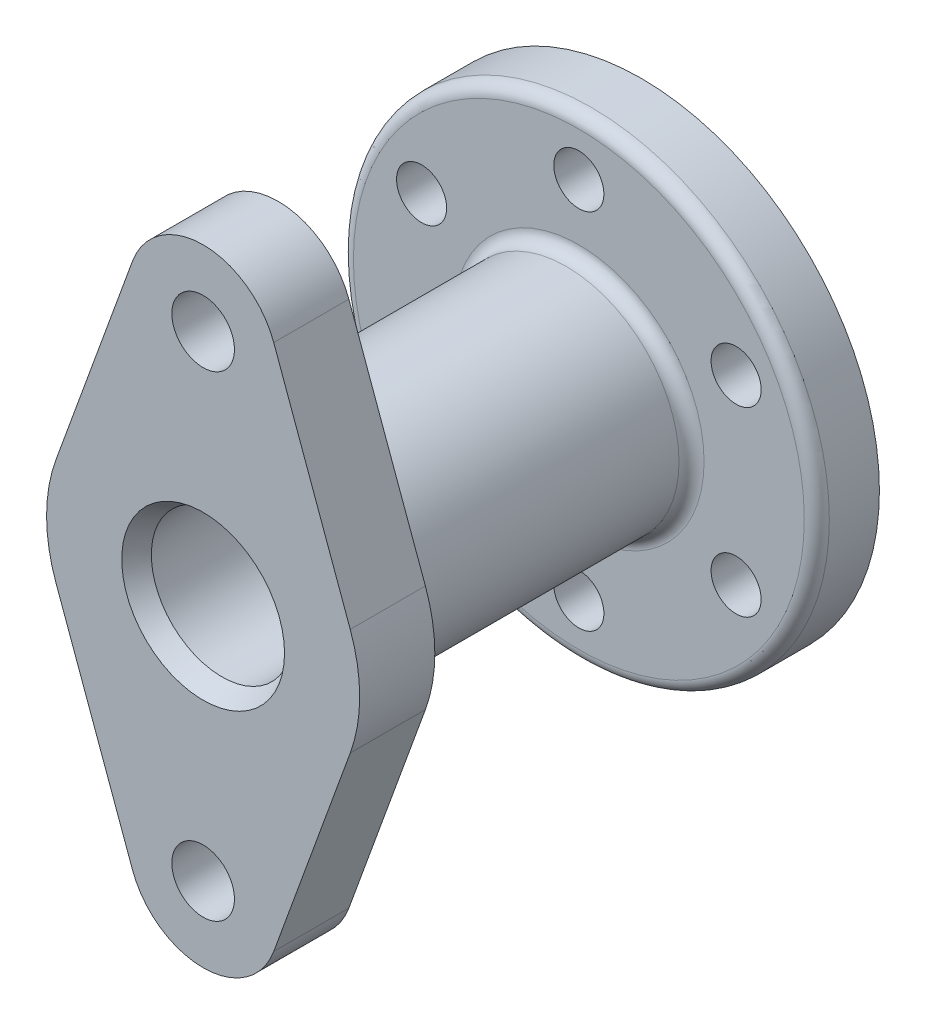
from build123d import *

# Parameters (mm, degrees)
SKETCH1_R           = 5
BOSS_EXTRUDE1_DEPTH = 6
SKETCH2_R           = 13
CUT_EXTRUDE1_DEPTH  = 3
CUT_EXTRUDE1_DRAFT  = -30
SKETCH3_R           = 18
BOSS_EXTRUDE2_DEPTH = 48
SKETCH4_R           = 38
BOSS_EXTRUDE3_DEPTH = 10
SKETCH5_R           = 11.267949192
CUT_EXTRUDE2_DEPTH  = 25
SKETCH6_R           = 10
CUT_EXTRUDE3_DEPTH  = 76.55130707
SKETCH7_R           = 4
CUT_EXTRUDE4_DEPTH  = 87.856203002
FILLET1_R           = 2


with BuildPart() as part:
    # Sketch1 → Boss-Extrude1 (new, symmetric)
    with BuildSketch(Plane.XY):
        with BuildLine():
            Line((23.491540883, -8.552631579), (11.275939624, -42.105263158))
            ThreePointArc((11.275939624, -42.105263158), (0, -50), (-11.275939624, -42.105263158))
            Line((-11.275939624, -42.105263158), (-23.491540883, -8.552631579))
            ThreePointArc((-23.491540883, -8.552631579), (-25, 0), (-23.491540883, 8.552631579))
            Line((-23.491540883, 8.552631579), (-11.275939624, 42.105263158))
            ThreePointArc((-11.275939624, 42.105263158), (0, 50), (11.275939624, 42.105263158))
            Line((11.275939624, 42.105263158), (23.491540883, 8.552631579))
            ThreePointArc((23.491540883, 8.552631579), (25, 0), (23.491540883, -8.552631579))
        make_face()
        with Locations((0, -38)):
            Circle(SKETCH1_R, mode=Mode.SUBTRACT)
        with Locations((0, 38)):
            Circle(SKETCH1_R, mode=Mode.SUBTRACT)
    extrude(amount=BOSS_EXTRUDE1_DEPTH, both=True)


with BuildPart() as cut_extrude1_tool:
    # Sketch2 → Cut-Extrude1 (with draft: the straight prism first)
    with BuildSketch(Plane.XY.offset(6)):
        Circle(SKETCH2_R)
    extrude(amount=-CUT_EXTRUDE1_DEPTH)
    # Cut-Extrude1: the draft: its side faces are tilted about the plane it starts from
    cut_extrude1_sides = [cut_extrude1_tool.faces().sort_by_distance(p)[0] for p in [
        (-13, 0, 4.5),
    ]]
    draft(cut_extrude1_sides, Plane.XY.offset(6), CUT_EXTRUDE1_DRAFT)


with BuildPart() as part_1:
    add(part.part)

    # Cut-Extrude1: cut by cut_extrude1_tool
    add(cut_extrude1_tool.part, mode=Mode.SUBTRACT)

    # Sketch3 → Boss-Extrude2 (add)
    with BuildSketch(Plane(origin=(0, 0, -6), x_dir=(-1, 0, 0), z_dir=(0, 0, -1))):
        with Locations(Location((0, 0, 0), (0, 0, 180))):
            Circle(SKETCH3_R)
    extrude(amount=BOSS_EXTRUDE2_DEPTH)

    # Sketch4 → Boss-Extrude3 (add)
    with BuildSketch(Plane(origin=(0, 0, -54), x_dir=(-1, 0, 0), z_dir=(0, 0, -1))):
        Circle(SKETCH4_R)
    extrude(amount=BOSS_EXTRUDE3_DEPTH)

    # Sketch5 → Cut-Extrude2 (cut)
    with BuildSketch(Plane.XY.offset(3)):
        Circle(SKETCH5_R)
    extrude(amount=-CUT_EXTRUDE2_DEPTH, mode=Mode.SUBTRACT)

    # Sketch6 → Cut-Extrude3 (cut, through all)
    with BuildSketch(Plane.XY.offset(-22)):
        Circle(SKETCH6_R)
    extrude(amount=-CUT_EXTRUDE3_DEPTH, mode=Mode.SUBTRACT)

    # Sketch7 → Cut-Extrude4 (cut, through all)
    with BuildSketch(Plane.XY.offset(-54)):
        with Locations((0, 29)):
            Circle(SKETCH7_R)
        with Locations((25.11473671, 14.5)):
            Circle(SKETCH7_R)
        with Locations((25.11473671, -14.5)):
            Circle(SKETCH7_R)
        with Locations((0, -29)):
            Circle(SKETCH7_R)
        with Locations((-25.11473671, -14.5)):
            Circle(SKETCH7_R)
        with Locations((-25.11473671, 14.5)):
            Circle(SKETCH7_R)
    extrude(amount=-CUT_EXTRUDE4_DEPTH, mode=Mode.SUBTRACT)

    # Fillet1
    fillet1_edges = [part_1.edges().sort_by_distance(p)[0] for p in [
        (-18, 0, -54),
        (38, 0, -54),
    ]]
    fillet(fillet1_edges, radius=FILLET1_R)


solid = part_1.part
